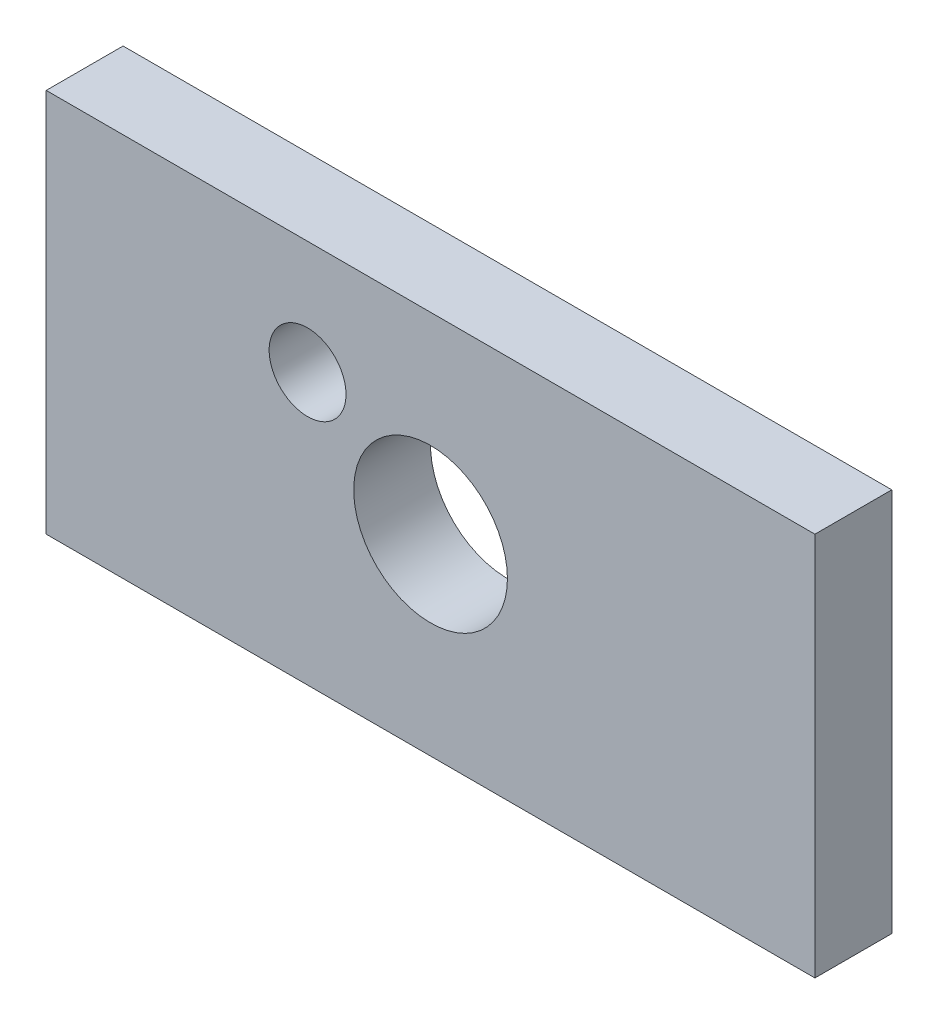
from build123d import *

# Parameters (mm, degrees)
SKETCH1_W           = 100
SKETCH1_H           = 50
SKETCH1_R           = 10
SKETCH1_R_2         = 5
BOSS_EXTRUDE1_DEPTH = 10


with BuildPart() as part:
    # Sketch1 → Boss-Extrude1 (new body)
    with BuildSketch(Plane.XY):
        with Locations((50, 25)):
            Rectangle(SKETCH1_W, SKETCH1_H)
        with Locations((50, 25)):
            Circle(SKETCH1_R, mode=Mode.SUBTRACT)
        with Locations((34, 35.246950766)):
            Circle(SKETCH1_R_2, mode=Mode.SUBTRACT)
    extrude(amount=BOSS_EXTRUDE1_DEPTH)


solid = part.part
